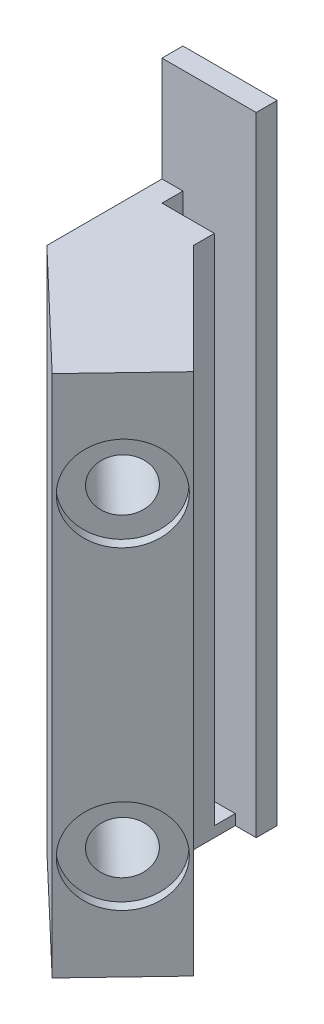
from build123d import *

# Parameters (mm, degrees)
BOSS_EXTRUDE1_DEPTH = 50
SKETCH2_W           = 9
SKETCH2_H           = 2
BOSS_EXTRUDE2_DEPTH = 10
SKETCH3_R           = 3.15
CUT_EXTRUDE1_DEPTH  = 1
BOSS_EXTRUDE3_DEPTH = 50
SKETCH5_W           = 5
SKETCH5_H           = 2
BOSS_EXTRUDE4_DEPTH = 1
SKETCH6_R           = 4.5
SKETCH6_R_2         = 2.5
CUT_EXTRUDE2_DEPTH  = 1
SKETCH6_2_R         = 2.5
CUT_EXTRUDE3_DEPTH  = 65.610577824


with BuildPart() as part:
    # Sketch1 → Boss-Extrude1 (new body)
    with BuildSketch(Plane(origin=(0, 0, 0), x_dir=(1, 0, 0), z_dir=(0, 1, 0))):
        Polygon((0, 0), (0, -6), (7, -6), (7, -4), (2, -4), (2, -2), (9, -2), (9, 0), align=None)
    extrude(amount=BOSS_EXTRUDE1_DEPTH)

    # Sketch2 → Boss-Extrude2 (add)
    with BuildSketch(Plane(origin=(0, 50, 0), x_dir=(1, 0, 0), z_dir=(0, 1, 0))):
        with Locations((4.5, -1)):
            Rectangle(SKETCH2_W, SKETCH2_H)
    extrude(amount=BOSS_EXTRUDE2_DEPTH)

    # Sketch3 → Cut-Extrude1 (cut)
    with BuildSketch(Plane(origin=(0, 0, 0), x_dir=(-1, 0, 0), z_dir=(0, 0, -1))):
        with Locations((-5.5, 55)):
            Circle(SKETCH3_R)
    extrude(amount=-CUT_EXTRUDE1_DEPTH, mode=Mode.SUBTRACT)

    # Sketch4 → Boss-Extrude3 (add)
    with BuildSketch(Plane.XZ):
        Polygon((0, 6), (7, 6), (17.441727636, 16.441727636), (10.857923623, 23.349178451), (0, 13), align=None)
    extrude(amount=-BOSS_EXTRUDE3_DEPTH)

    # Sketch5 → Boss-Extrude4 (add)
    with BuildSketch(Plane.XZ):
        with Locations((4.5, 3)):
            Rectangle(SKETCH5_W, SKETCH5_H)
    extrude(amount=-BOSS_EXTRUDE4_DEPTH)

    # Sketch6 → Cut-Extrude2 (cut)
    # profile 1 of 2: a face of its own
    with BuildSketch(Plane(origin=(17.350446553, 0, 16.537495917), x_dir=(0.6899452300561162, 0, -0.7238615748351429), z_dir=(0.7238615748351429, 0, 0.6899452300561162))):
        with Locations((-4.638949273, 40)):
            Circle(SKETCH6_R)
        with Locations((-4.638949273, 40)):
            Circle(SKETCH6_R_2, mode=Mode.SUBTRACT)
    # profile 2 of 2: a face of its own
    with BuildSketch(Plane(origin=(17.350446553, 0, 16.537495917), x_dir=(0.6899452300561162, 0, -0.7238615748351429), z_dir=(0.7238615748351429, 0, 0.6899452300561162))):
        with Locations((-4.638949273, 10)):
            Circle(SKETCH6_R)
        with Locations((-4.638949273, 10)):
            Circle(SKETCH6_R_2, mode=Mode.SUBTRACT)
    extrude(amount=-CUT_EXTRUDE2_DEPTH, mode=Mode.SUBTRACT)

    # Sketch6<2> → Cut-Extrude3 (cut, through all)
    with BuildSketch(Plane(origin=(17.350446553, 0, 16.537495917), x_dir=(0.6899452300561162, 0, -0.7238615748351429), z_dir=(0.7238615748351429, 0, 0.6899452300561162))):
        with Locations((-4.638949273, 40)):
            Circle(SKETCH6_2_R)
        with Locations((-4.638949273, 10)):
            Circle(SKETCH6_2_R)
    extrude(amount=-CUT_EXTRUDE3_DEPTH, mode=Mode.SUBTRACT)


solid = part.part
